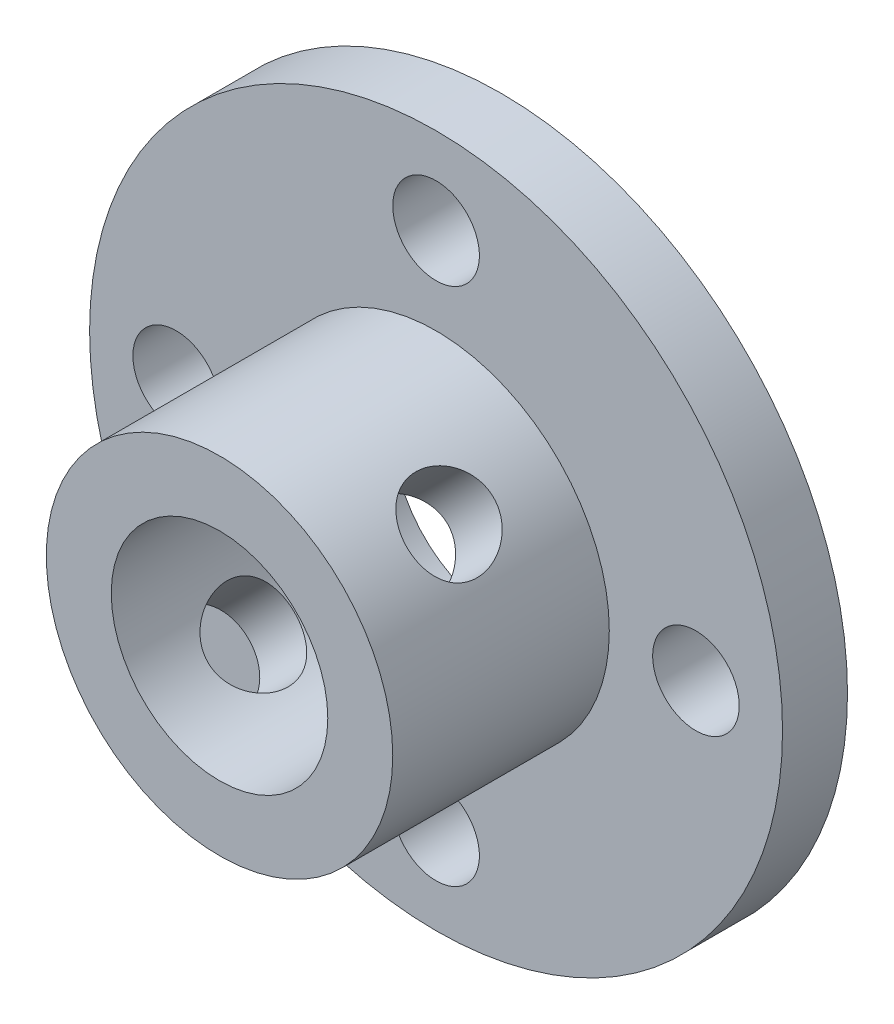
from build123d import *
from build123d.topology import SkipClean

# Parameters (mm, degrees)
SKETCH_1_R               = 8
SKETCH_1_R_2             = 5
EXTRUDE_1_DEPTH          = 10
EXTRUDE_START            = 3
SKETCH_2_R               = 16
SKETCH_2_R_2             = 5
SKETCH_2_R_3             = 2
EXTRUDE_2_DEPTH          = 3
CUT_EXTRUDE_1_DEPTH      = 10
CUT_EXTRUDE_1_DEPTH_BACK = 10
SKETCH_3_R               = 2


with BuildPart() as part:
    # 草图1 → 凸台-拉伸1 (new body)
    with BuildSketch(Plane.XY):
        Circle(SKETCH_1_R)
        Circle(SKETCH_1_R_2, mode=Mode.SUBTRACT)
    extrude(amount=EXTRUDE_1_DEPTH)

    # 草图2 → 凸台-拉伸2 (add)
    with SkipClean():  # the faces are left unmerged after this step: merging them gives an invalid solid
        with BuildSketch(Plane(origin=(0, 0, 0), x_dir=(-1, 0, 0), z_dir=(0, 0, -1)).offset(EXTRUDE_START)):
            Circle(SKETCH_2_R)
            Circle(SKETCH_2_R_2, mode=Mode.SUBTRACT)
            with Locations((-12, 0)):
                Circle(SKETCH_2_R_3, mode=Mode.SUBTRACT)
            with Locations((0, 12)):
                Circle(SKETCH_2_R_3, mode=Mode.SUBTRACT)
            with Locations((12, 0)):
                Circle(SKETCH_2_R_3, mode=Mode.SUBTRACT)
            with Locations((0, -12)):
                Circle(SKETCH_2_R_3, mode=Mode.SUBTRACT)
        extrude(amount=-EXTRUDE_2_DEPTH)

    # 草图3 → 切除-拉伸1 (cut, two sides: drawn at the far end of the back side and taken through both)
    with SkipClean():  # the faces are left unmerged after this step: merging them gives an invalid solid
        with BuildSketch(Plane(origin=(0, 0, 0), x_dir=(0, 0, -1), z_dir=(0.7071067811865488, 0.7071067811865464, 0)).offset(-CUT_EXTRUDE_1_DEPTH_BACK)):
            with Locations((-5, 0)):
                Circle(SKETCH_3_R)
        extrude(amount=CUT_EXTRUDE_1_DEPTH + CUT_EXTRUDE_1_DEPTH_BACK, mode=Mode.SUBTRACT)


solid = part.part
